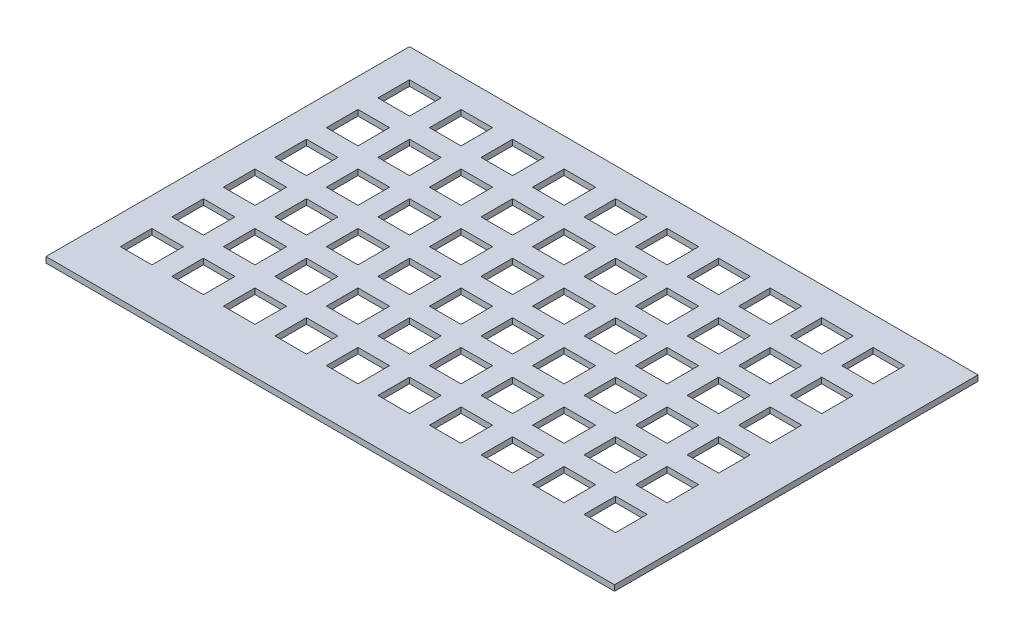
from build123d import *

# Parameters (mm, degrees)
SKETCH1_W            = 252.22307324
SKETCH1_H            = 161.278122816
BOSS_EXTRUDE1_DEPTH  = 2.54
SKETCH2_W            = 14
SKETCH2_H            = 14
CUT_EXTRUDE1_DEPTH   = 150.710485583
LPATTERN2_COUNT      = 6
LPATTERN2_PITCH      = 22.86
LPATTERN2_COUNT_DIR2 = 10
LPATTERN2_PITCH_DIR2 = 22.86


with BuildPart() as part:
    # Sketch1 → Boss-Extrude1 (new body)
    with BuildSketch(Plane(origin=(0, 0, 0), x_dir=(1, 0, 0), z_dir=(0, 1, 0))):
        Rectangle(SKETCH1_W, SKETCH1_H)
    extrude(amount=-BOSS_EXTRUDE1_DEPTH)

    # Sketch2 → Cut-Extrude1 (cut, through all)
    with BuildSketch(Plane(origin=(0, 0, 0), x_dir=(1, 0, 0), z_dir=(0, 1, 0))):
        with Locations((-106.41153662, 60.939061408)):
            Rectangle(SKETCH2_W, SKETCH2_H)
    cut_extrude1 = extrude(amount=-CUT_EXTRUDE1_DEPTH, mode=Mode.SUBTRACT)

    # LPattern2: Cut-Extrude1 6 × 10
    with Locations(*[(j * LPATTERN2_PITCH_DIR2, 0, i * LPATTERN2_PITCH) for i in range(LPATTERN2_COUNT) for j in range(LPATTERN2_COUNT_DIR2) if (i, j) != (0, 0)]):
        add(cut_extrude1, mode=Mode.SUBTRACT)


solid = part.part
